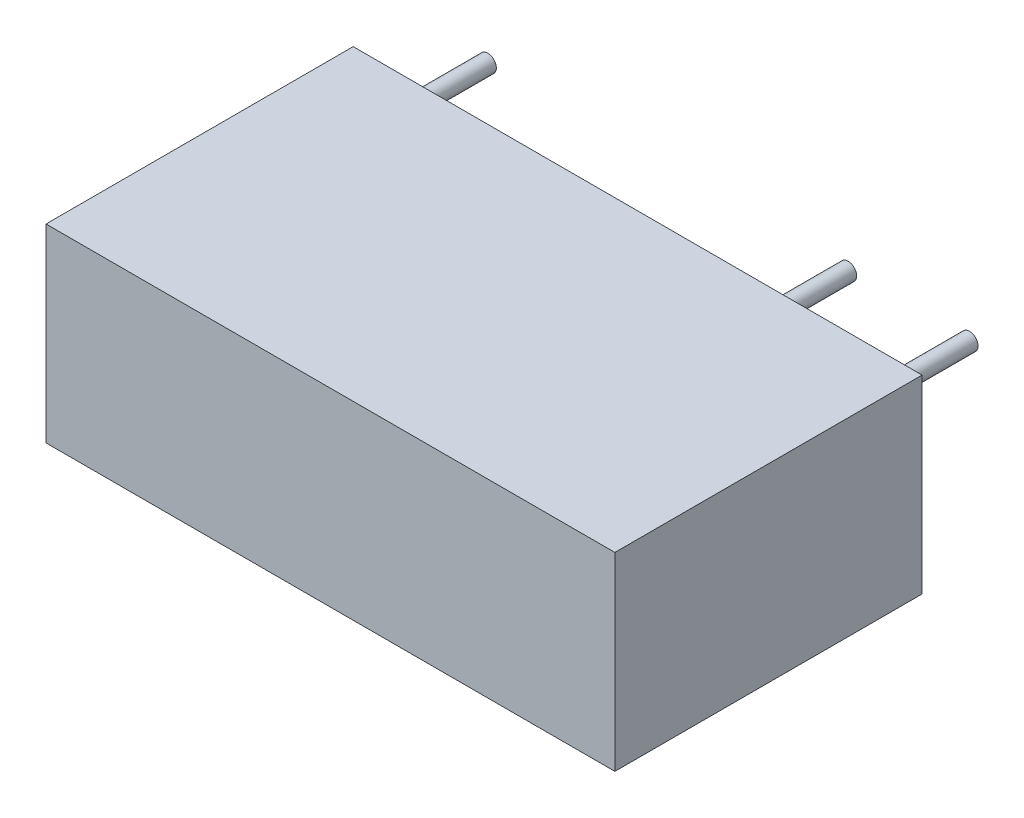
from build123d import *

# Parameters (mm, degrees)
SKETCH_1_W      = 30
SKETCH_1_H      = 10
EXTRUDE_1_DEPTH = 16.2
SKETCH_2_R      = 0.45
EXTRUDE_2_DEPTH = 4


with BuildPart() as part:
    # Эскиз1 → Бобышка-Вытянуть1 (new body)
    with BuildSketch(Plane.XY):
        Rectangle(SKETCH_1_W, SKETCH_1_H)
    extrude(amount=EXTRUDE_1_DEPTH)

    # Эскиз2 → Бобышка-Вытянуть2 (add)
    with BuildSketch(Plane(origin=(0, 0, 0), x_dir=(-1, 0, 0), z_dir=(0, 0, -1))):
        with Locations((-13.5, 3.8)):
            Circle(SKETCH_2_R)
        with Locations((-7.1, 3.8)):
            Circle(SKETCH_2_R)
        with Locations((-10.3, -3.8)):
            Circle(SKETCH_2_R)
        with Locations((11.9, 3.8)):
            Circle(SKETCH_2_R)
        with Locations((11.9, -3.8)):
            Circle(SKETCH_2_R)
    extrude(amount=EXTRUDE_2_DEPTH)


solid = part.part
